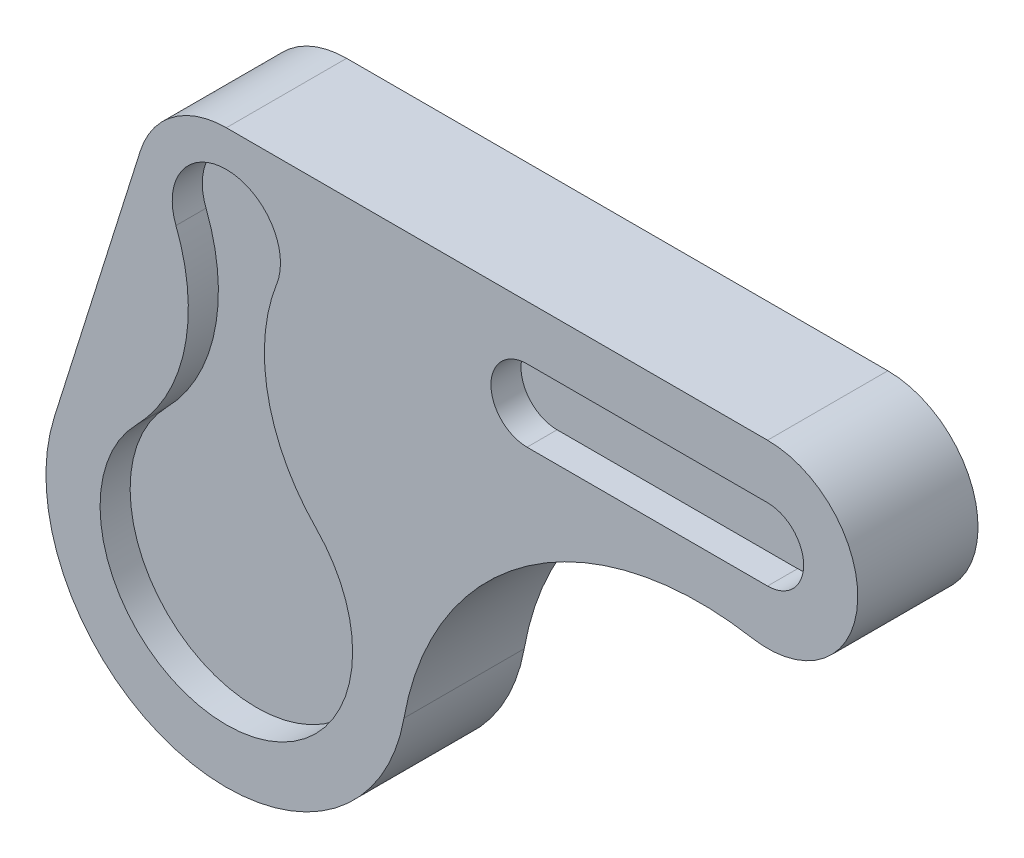
from build123d import *

# Parameters (mm, degrees)
BOSS_EXTRUDE1_DEPTH   = 5
BOSS_EXTRUDE1_2_DEPTH = 5
BOSS_EXTRUDE2_START   = -10
BOSS_EXTRUDE2_DEPTH   = 20


with BuildPart() as part:
    # Sketch1 → Boss-Extrude1 (new, symmetric)
    with BuildSketch(Plane.XY):
        with BuildLine():
            Line((90, 44), (50, 44))
            ThreePointArc((50, 44), (44, 50), (50, 56))
            Line((50, 56), (90, 56))
            ThreePointArc((90, 56), (96, 50), (90, 44))
        make_face()
    extrude(amount=BOSS_EXTRUDE1_DEPTH, both=True)



with BuildPart() as body_2:
    # Sketch1 → Boss-Extrude1 2 (new, symmetric)
    with BuildSketch(Plane.XY):
        with BuildLine():
            ThreePointArc((-14.956527547, 14.741176471), (0, -21), (14.956527547, 14.741176471))
            ThreePointArc((14.956527547, 14.741176471), (6.937432482, 29.759413292), (8.382229724, 46.723076923))
            ThreePointArc((8.382229724, 46.723076923), (0, 59), (-8.382229724, 46.723076923))
            ThreePointArc((-8.382229724, 46.723076923), (-6.937432482, 29.759413292), (-14.956527547, 14.741176471))
        make_face()
    extrude(amount=BOSS_EXTRUDE1_2_DEPTH, both=True)


with BuildPart() as part_1:
    add(part.part)

    add(body_2.part)  # Boss-Extrude2 merges body 2
    # Sketch1<4> → Boss-Extrude2 (add)
    with BuildSketch(Plane.XY.offset(BOSS_EXTRUDE2_START)):
        with BuildLine():
            Line((0, 65), (90, 65))
            ThreePointArc((90, 65), (104.943418217, 48.698365648), (87.406551135, 35.225900265))
            ThreePointArc((87.406551135, 35.225900265), (50.100874494, 26.949083525), (29.535645594, -5.25791207))
            ThreePointArc((29.535645594, -5.25791207), (-7.143700144, -29.137047693), (-28.618176043, 9))
            Line((-28.618176043, 9), (-14.309088021, 54.5))
            ThreePointArc((-14.309088021, 54.5), (-8.874119675, 62.093386622), (0, 65))
        make_face()
        with BuildLine():
            Line((90, 44), (50, 44))
            ThreePointArc((50, 44), (44, 50), (50, 56))
            Line((50, 56), (90, 56))
            ThreePointArc((90, 56), (96, 50), (90, 44))
        make_face(mode=Mode.SUBTRACT)
        with BuildLine():
            ThreePointArc((-14.956527547, 14.741176471), (0, -21), (14.956527547, 14.741176471))
            ThreePointArc((14.956527547, 14.741176471), (6.937432482, 29.759413292), (8.382229724, 46.723076923))
            ThreePointArc((8.382229724, 46.723076923), (0, 59), (-8.382229724, 46.723076923))
            ThreePointArc((-8.382229724, 46.723076923), (-6.937432482, 29.759413292), (-14.956527547, 14.741176471))
        make_face(mode=Mode.SUBTRACT)
    extrude(amount=BOSS_EXTRUDE2_DEPTH)


solid = part_1.part
